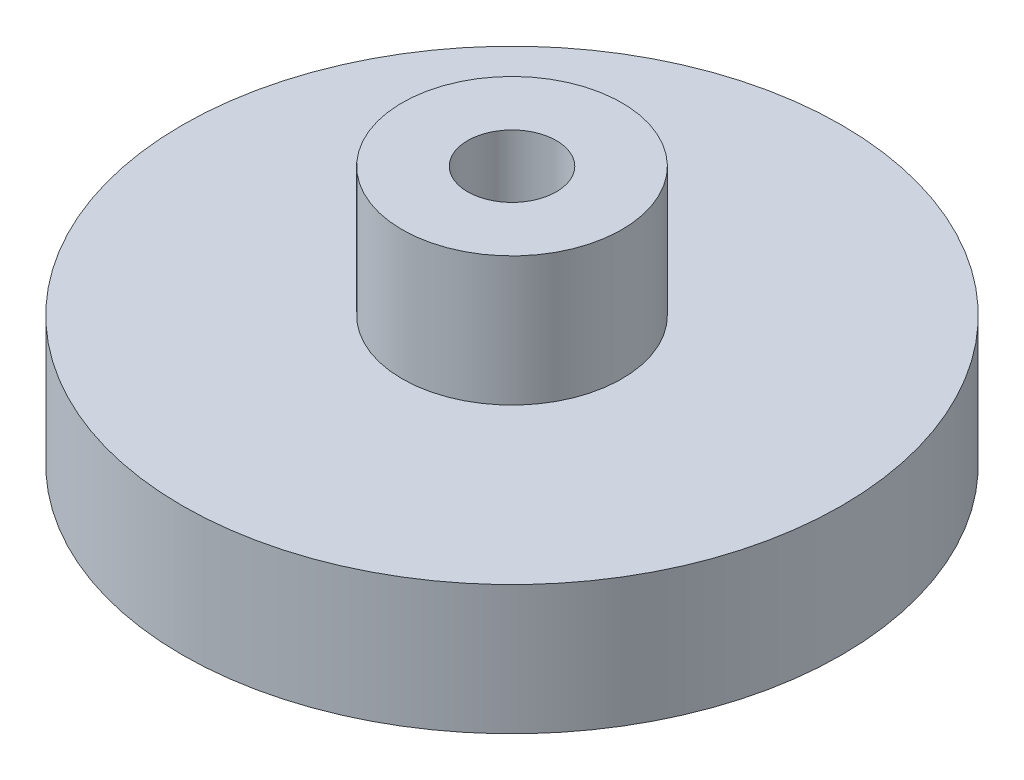
from build123d import *

# Parameters (mm, degrees)
SKETCH1_R           = 14.85
SKETCH1_R_2         = 2
BOSS_EXTRUDE1_DEPTH = 5.82
SKETCH2_R           = 4.95
SKETCH2_R_2         = 2
BOSS_EXTRUDE2_DEPTH = 5.82


with BuildPart() as part:
    # Sketch1 → Boss-Extrude1 (new body)
    with BuildSketch(Plane(origin=(0, 0, 0), x_dir=(1, 0, 0), z_dir=(0, 1, 0))):
        with Locations(Location((0, 0, 0), (0, 0, 270))):
            Circle(SKETCH1_R)
        with Locations(Location((0, 0, 0), (0, 0, 270))):
            Circle(SKETCH1_R_2, mode=Mode.SUBTRACT)
    extrude(amount=BOSS_EXTRUDE1_DEPTH)

    # Sketch2 → Boss-Extrude2 (add)
    with BuildSketch(Plane(origin=(0, 5.82, 0), x_dir=(1, 0, 0), z_dir=(0, 1, 0))):
        with Locations(Location((0, 0, 0), (0, 0, 270))):
            Circle(SKETCH2_R)
        with Locations(Location((0, 0, 0), (0, 0, 270))):
            Circle(SKETCH2_R_2, mode=Mode.SUBTRACT)
    extrude(amount=BOSS_EXTRUDE2_DEPTH)


solid = part.part
